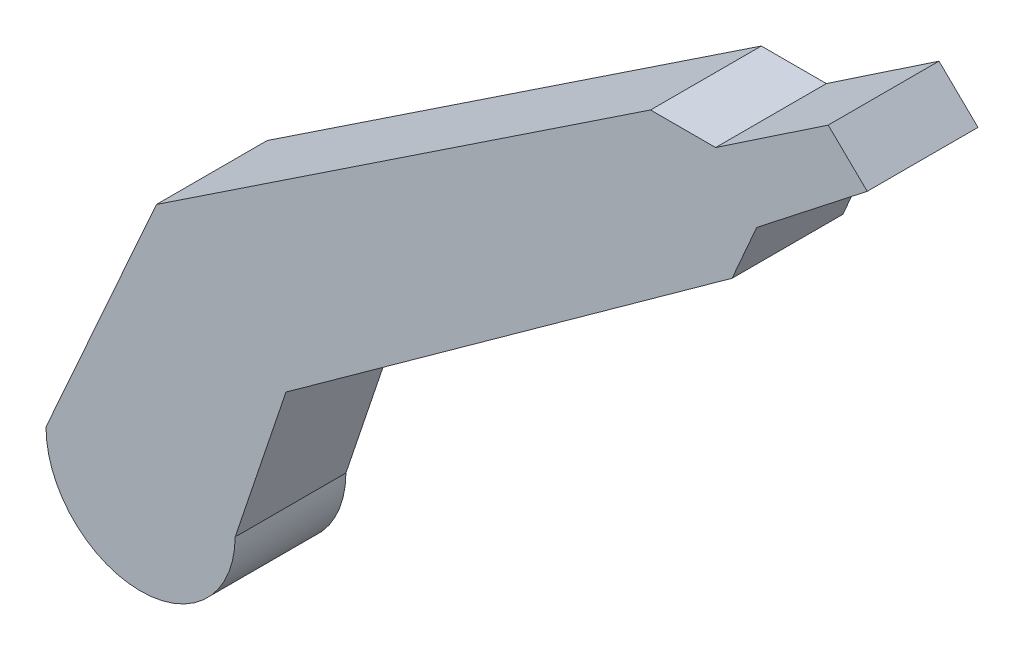
from build123d import *

# Parameters (mm, degrees)
BOSS_EXTRUDE1_DEPTH = 15


with BuildPart() as part:
    # Sketch1 → Boss-Extrude1 (new body)
    with BuildSketch(Plane.XY):
        with BuildLine():
            Line((-4.967004399, 8.835776472), (-71.884952029, -35.707198588))
            Line((-71.884952029, -35.707198588), (-86.833591926, -69.261290707))
            ThreePointArc((-86.833591926, -69.261290707), (-74.078855086, -82.121498504), (-61.218647289, -69.366761664))
            Line((-61.218647289, -69.366761664), (-54.340359202, -48.936608433))
            Line((-54.340359202, -48.936608433), (6.077760006, -5.382226646))
            Line((6.077760006, -5.382226646), (9.40798921, 2.245366823))
            Line((9.40798921, 2.245366823), (24.377091509, 13.963829782))
            Line((24.377091509, 13.963829782), (19.091883092, 19.091883092))
            Line((19.091883092, 19.091883092), (3.844956844, 8.835776472))
            Line((3.844956844, 8.835776472), (-4.967004399, 8.835776472))
        make_face()
    extrude(amount=-BOSS_EXTRUDE1_DEPTH)


solid = part.part
